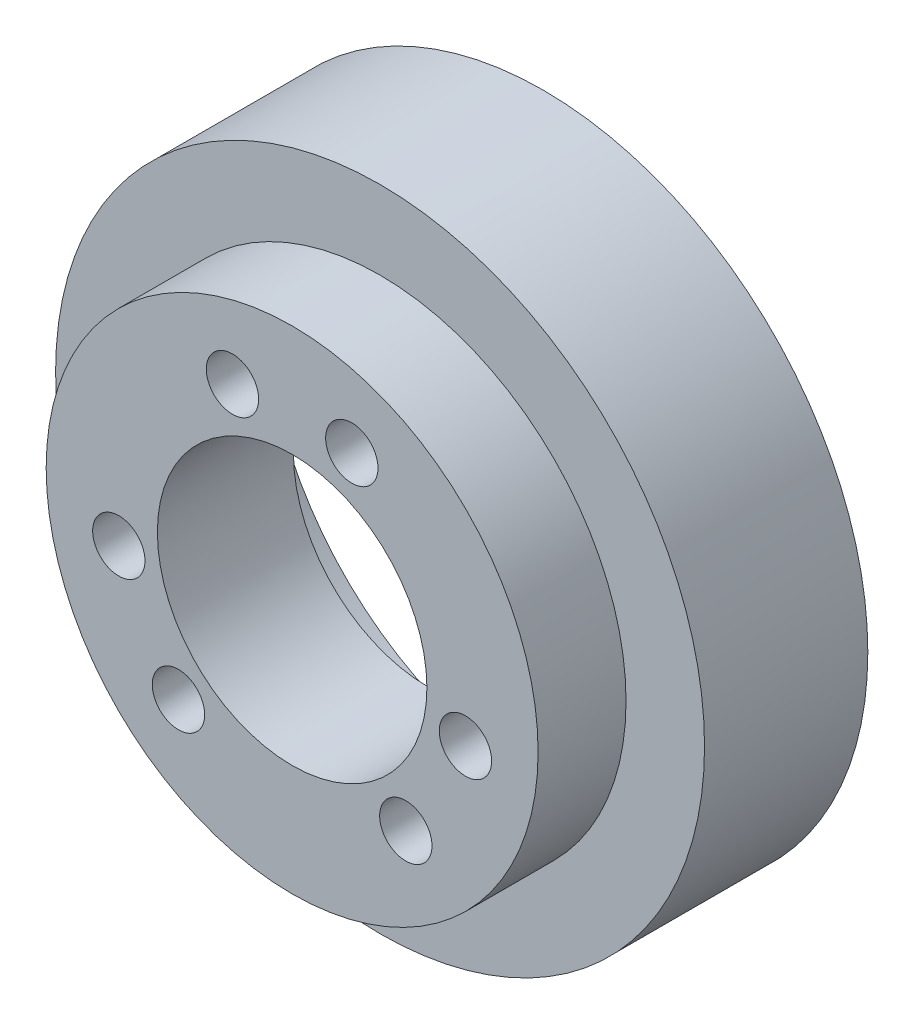
from build123d import *

# Parameters (mm, degrees)
SKETCH1_R             = 31
BOSS_EXTRUDE1_DEPTH   = 15.6
SKETCH2_R             = 23.5
BOSS_EXTRUDE2_DEPTH   = 8.4
SKETCH3_R             = 12.875
CUT_EXTRUDE1_DEPTH    = 50.979995998
SKETCH4_R             = 26.625
CUT_EXTRUDE2_DEPTH    = 11
M6X1_0_TAPPED_HOLE1_D = 5
CIRPATTERN1_COUNT     = 3


with BuildPart() as part:
    # Sketch1 → Boss-Extrude1 (new body)
    with BuildSketch(Plane.XY):
        Circle(SKETCH1_R)
    extrude(amount=BOSS_EXTRUDE1_DEPTH)

    # Sketch2 → Boss-Extrude2 (add)
    with BuildSketch(Plane.XY.offset(15.6)):
        Circle(SKETCH2_R)
    extrude(amount=BOSS_EXTRUDE2_DEPTH)

    # Sketch3 → Cut-Extrude1 (cut, through all)
    with BuildSketch(Plane.XY.offset(24)):
        Circle(SKETCH3_R)
    extrude(amount=-CUT_EXTRUDE1_DEPTH, mode=Mode.SUBTRACT)

    # Sketch4 → Cut-Extrude2 (cut)
    with BuildSketch(Plane(origin=(0, 0, 0), x_dir=(-1, 0, 0), z_dir=(0, 0, -1))):
        Circle(SKETCH4_R)
    extrude(amount=-CUT_EXTRUDE2_DEPTH, mode=Mode.SUBTRACT)

    # M6x1.0 Tapped Hole1 (through all)
    with Locations(Plane.XY.offset(24)):
        with Locations((-5.7, 15.830054485), (5.7, 15.830054485)):
            m6x1_0_tapped_hole1 = Hole(M6X1_0_TAPPED_HOLE1_D / 2)

    # CirPattern1: M6x1.0 Tapped Hole1 ×3 about axis
    cirpattern1_axis = Axis((0, 0, 0), (0, 0, 1))
    for i in range(1, CIRPATTERN1_COUNT):
        add(m6x1_0_tapped_hole1.rotate(cirpattern1_axis, i * 360 / CIRPATTERN1_COUNT), mode=Mode.SUBTRACT)


solid = part.part
